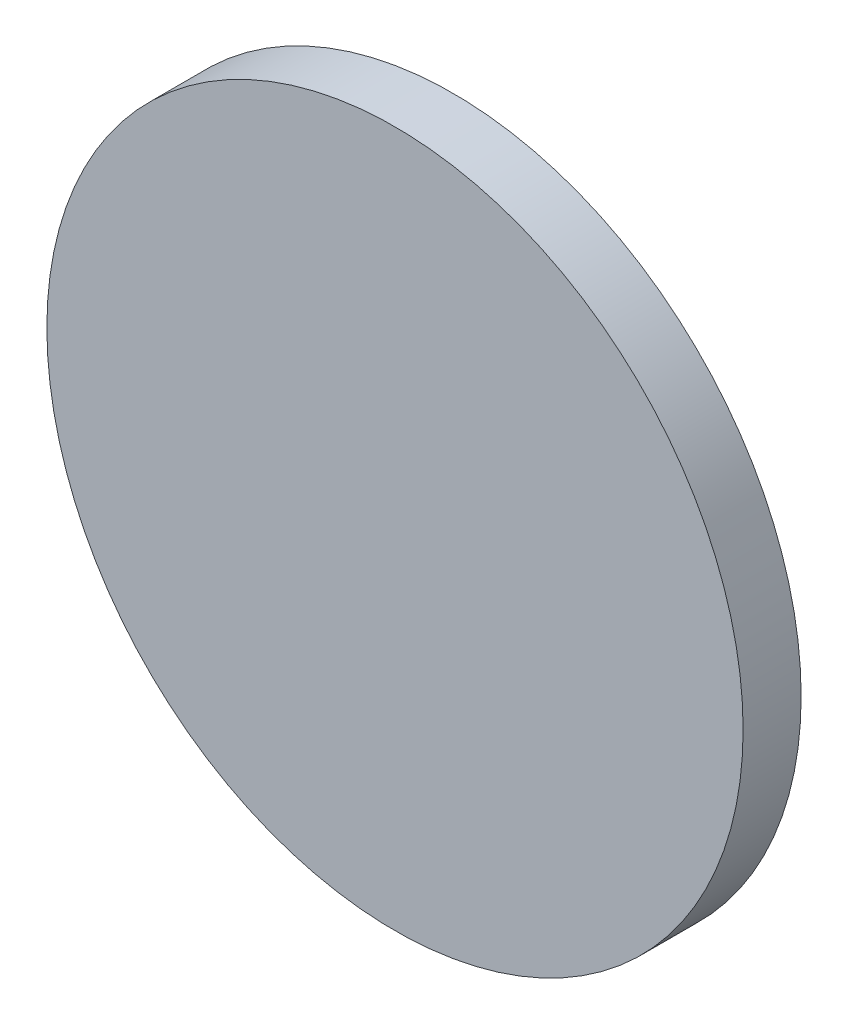
from build123d import *

# Parameters (mm, degrees)
SKETCH1_R      = 114.3
EXTRUDE1_DEPTH = 19.05


with BuildPart() as part:
    # Sketch1 → Extrude1 (new body)
    with BuildSketch(Plane.XY):
        with Locations(Location((0, 0, 0), (0, 0, 180))):
            Circle(SKETCH1_R)
    extrude(amount=EXTRUDE1_DEPTH)


solid = part.part
